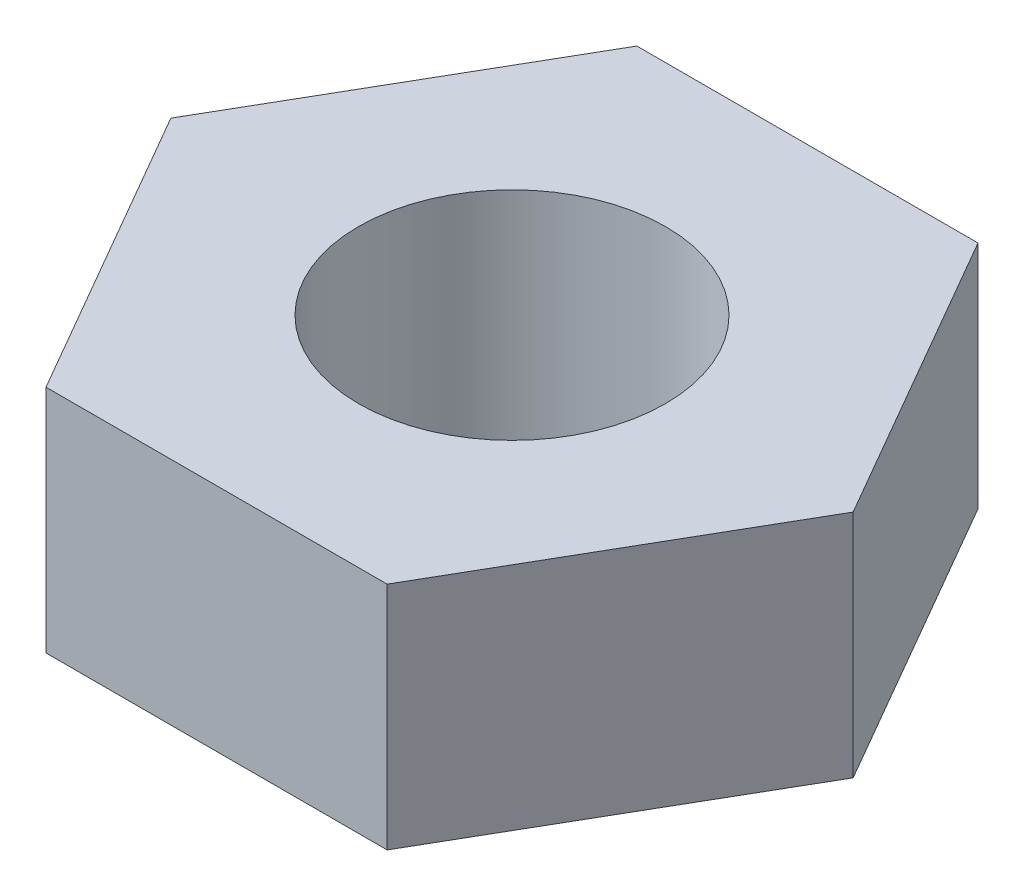
from build123d import *

# Parameters (mm, degrees)
SKETCH1_R           = 1
BOSS_EXTRUDE1_DEPTH = 1.5


with BuildPart() as part:
    # Sketch1 → Boss-Extrude1 (new body)
    with BuildSketch(Plane(origin=(0, 0, 0), x_dir=(1, 0, 0), z_dir=(0, 1, 0))):
        Polygon((1.111399268, 1.925), (-1.111399268, 1.925), (-2.222798536, 0), (-1.111399268, -1.925), (1.111399268, -1.925), (2.222798536, 0), align=None)
        with Locations(Location((0, 0, 0), (0, 0, 270))):
            Circle(SKETCH1_R, mode=Mode.SUBTRACT)
    extrude(amount=BOSS_EXTRUDE1_DEPTH)


solid = part.part
